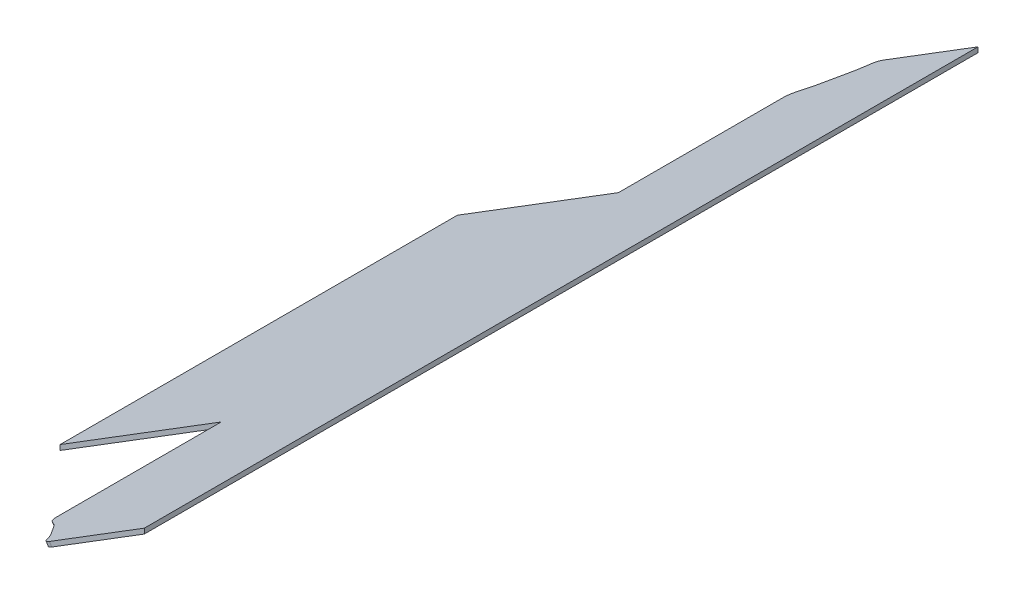
from build123d import *

# Parameters (mm, degrees)
SKETCH1_W           = 163.150096709
SKETCH1_H           = 382
BOSS_EXTRUDE1_DEPTH = 2
SKETCH2_W           = 86.892857143
SKETCH2_H           = 128
CUT_EXTRUDE1_DEPTH  = 582.357037259
SKETCH3_W           = 86.892857143
SKETCH3_H           = 100
CUT_EXTRUDE2_DEPTH  = 582.357037259
DRAFT1_ANGLE        = -31.857998891
DRAFT2_ANGLE        = 31.857998891
CUT_EXTRUDE3_DEPTH  = 581.711321285
FILLET1_R           = 5


with BuildPart() as part:
    # Sketch1 → Boss-Extrude1 (new body)
    with BuildSketch(Plane(origin=(184.061246273, -296.190511244, 0), x_dir=(-0.8493588352433418, -0.5278158476155048, 0), z_dir=(-0.5278158476155048, 0.8493588352433418, 0))):
        with Locations((-337.492534105, -211)):
            Rectangle(SKETCH1_W, SKETCH1_H)
    extrude(amount=-BOSS_EXTRUDE1_DEPTH)

    # Sketch2 → Cut-Extrude1 (cut, through all)
    with BuildSketch(Plane(origin=(185.116877969, -297.889228915, 0), x_dir=(0.8493588352433415, 0.5278158476155054, 0), z_dir=(0.5278158476155053, -0.8493588352433414, 0))):
        with Locations((299.363914323, -56)):
            Rectangle(SKETCH2_W, SKETCH2_H)
    extrude(amount=-CUT_EXTRUDE1_DEPTH, mode=Mode.SUBTRACT)

    # Sketch3 → Cut-Extrude2 (cut, through all)
    with BuildSketch(Plane(origin=(185.116877969, -297.889228915, 0), x_dir=(0.8493588352433415, 0.5278158476155054, 0), z_dir=(0.5278158476155053, -0.8493588352433414, 0))):
        with Locations((299.363914323, -352)):
            Rectangle(SKETCH3_W, SKETCH3_H)
    extrude(amount=-CUT_EXTRUDE2_DEPTH, mode=Mode.SUBTRACT)

    # Draft1
    draft1_faces = [part.faces().sort_by_distance(p)[0] for p in [
        (540.527815848, -75.849358835, -211),
    ]]
    draft(draft1_faces, Plane(origin=(184.061246273, -296.190511244, 0), x_dir=(0.8493588352433418, 0.5278158476155048, 0), z_dir=(-0.5278158476155048, 0.8493588352433418, 0)), DRAFT1_ANGLE)

    # Draft2
    draft2_faces = [part.faces().sort_by_distance(p)[0] for p in [
        (401.954839737, -161.962565418, -211),
    ]]
    draft(draft2_faces, Plane(origin=(184.061246273, -296.190511244, 0), x_dir=(0.8493588352433418, 0.5278158476155048, 0), z_dir=(-0.5278158476155048, 0.8493588352433418, 0)), DRAFT2_ANGLE)

    # Sketch4 → Cut-Extrude3 (cut, through all)
    with BuildSketch(Plane(origin=(185.116877969, -297.889228915, 0), x_dir=(0.8493588352433418, 0.5278158476155048, 0), z_dir=(0.5278158476155048, -0.8493588352433418, 0))):
        with BuildLine():
            Line((342.810342894, -20), (364.810342894, -20))
            add(Edge.make_bspline(
                [(342.810342894, -42), (346.302683554, -39.942808378), (351.300668251, -36.660712559), (356.350274178, -31.060781412), (361.089343651, -26.696748792), (363.56593564, -22.694365369), (364.810342894, -20)],
                knots=[0, 0, 0, 0, 0.388085015, 0.560148038, 0.716552584, 1, 1, 1, 1], degree=3))
            Line((342.810342894, -42), (342.810342894, -20))
        make_face()
        with BuildLine():
            Line((342.810342894, -380), (342.810342894, -402))
            Line((342.810342894, -402), (364.810342894, -402))
            add(Edge.make_bspline(
                [(342.810342894, -380), (346.302683554, -382.057191622), (351.300668251, -385.339287441), (356.350274178, -390.939218588), (361.089343651, -395.303251208), (363.56593564, -399.305634631), (364.810342894, -402)],
                knots=[0, 0, 0, 0, 0.388085015, 0.560148038, 0.716552584, 1, 1, 1, 1], degree=3))
        make_face()
    extrude(amount=-CUT_EXTRUDE3_DEPTH, mode=Mode.SUBTRACT)

    # Fillet1
    fillet1_edges = [part.edges().sort_by_distance(p)[0] for p in [
        (494.443950046, -104.487189726, -20),
        (475.758055671, -116.099138374, -42),
        (494.443950046, -104.487189726, -402),
        (475.758055671, -116.099138374, -380),
    ]]
    fillet(fillet1_edges, radius=FILLET1_R)


solid = part.part
